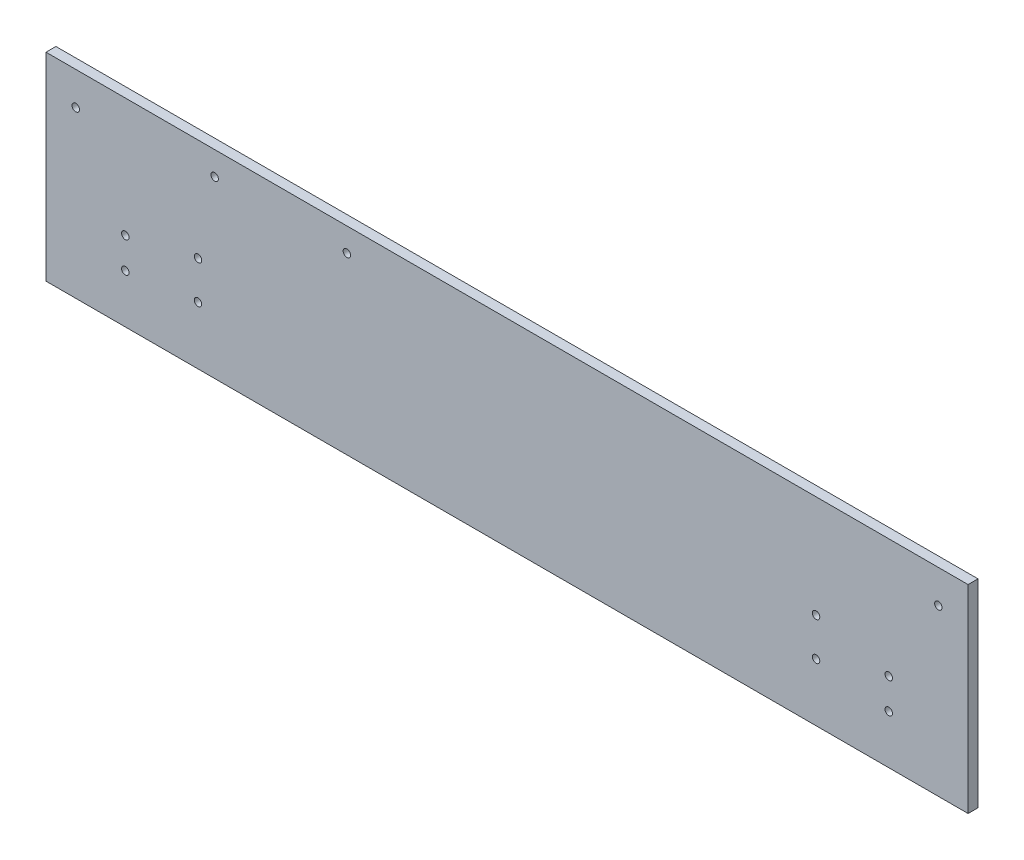
from build123d import *

# Parameters (mm, degrees)
SCHIZZO1_W                   = 558
SCHIZZO1_H                   = 120
ESTRUSIONE_ESTRUSIONE1_DEPTH = 6
SCHIZZO2_R                   = 2.25
TAGLIO_ESTRUSIONE1_DEPTH     = 10


with BuildPart() as part:
    # Schizzo1 → Estrusione-Estrusione1 (new body)
    with BuildSketch(Plane.XY):
        Rectangle(SCHIZZO1_W, SCHIZZO1_H)
    extrude(amount=ESTRUSIONE_ESTRUSIONE1_DEPTH)

    # Schizzo2 → Taglio-Estrusione1 (cut)
    with BuildSketch(Plane(origin=(0, 0, 0), x_dir=(-1, 0, 0), z_dir=(0, 0, -1))):
        with Locations((-231, -12)):
            Circle(SCHIZZO2_R)
        with Locations((-231, -30.5)):
            Circle(SCHIZZO2_R)
        with Locations((231, -12)):
            Circle(SCHIZZO2_R)
        with Locations((231, -30.5)):
            Circle(SCHIZZO2_R)
        with Locations((-261, 40)):
            Circle(SCHIZZO2_R)
        with Locations((261, 40)):
            Circle(SCHIZZO2_R)
        with Locations((-187, -25)):
            Circle(SCHIZZO2_R)
        with Locations((-187, -2)):
            Circle(SCHIZZO2_R)
        with Locations((187, -25)):
            Circle(SCHIZZO2_R)
        with Locations((187, -2)):
            Circle(SCHIZZO2_R)
        with Locations((176.925688, 45.7)):
            Circle(SCHIZZO2_R)
        with Locations((96.925688, 45.7)):
            Circle(SCHIZZO2_R)
    extrude(amount=-TAGLIO_ESTRUSIONE1_DEPTH, mode=Mode.SUBTRACT)


solid = part.part
